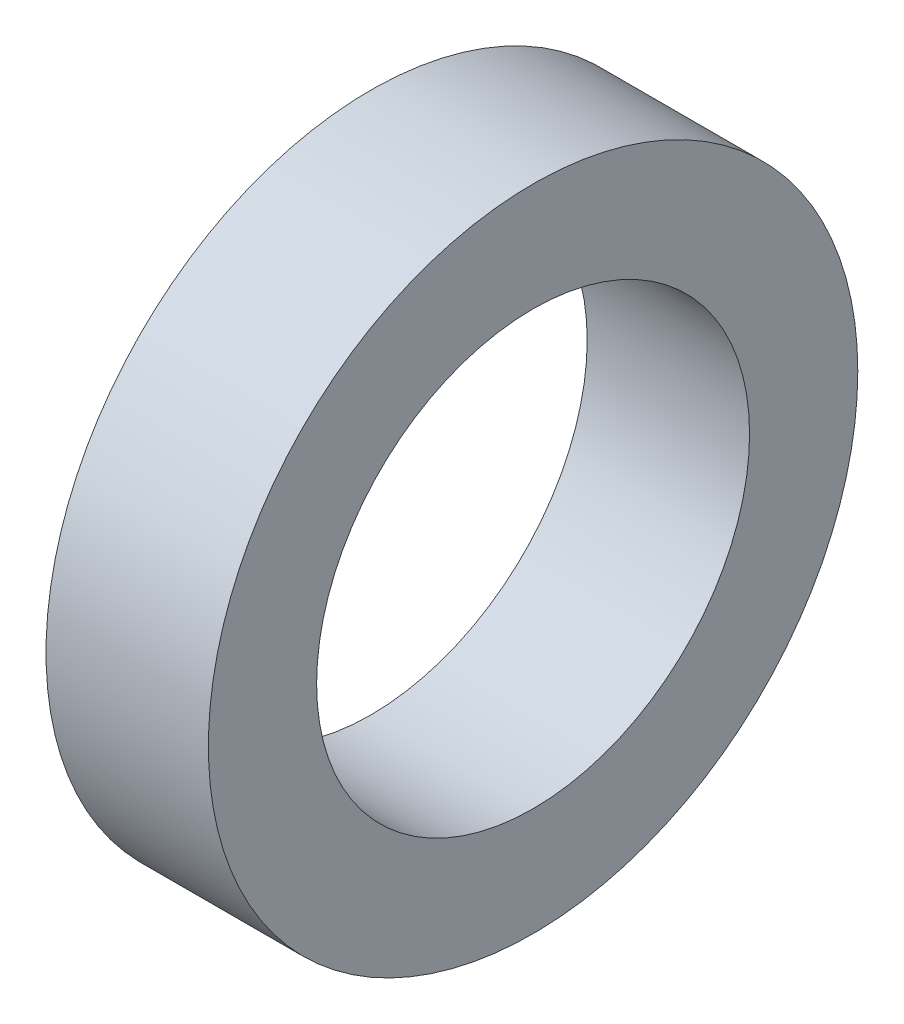
from build123d import *

# Parameters (mm, degrees)
SKETCH1_R           = 6
SKETCH1_R_2         = 4
BOSS_EXTRUDE1_DEPTH = 3


with BuildPart() as part:
    # Sketch1 → Boss-Extrude1 (new body)
    with BuildSketch(Plane(origin=(0, 0, 0), x_dir=(0, 0, -1), z_dir=(1, 0, 0))):
        Circle(SKETCH1_R)
        Circle(SKETCH1_R_2, mode=Mode.SUBTRACT)
    extrude(amount=BOSS_EXTRUDE1_DEPTH)


solid = part.part
